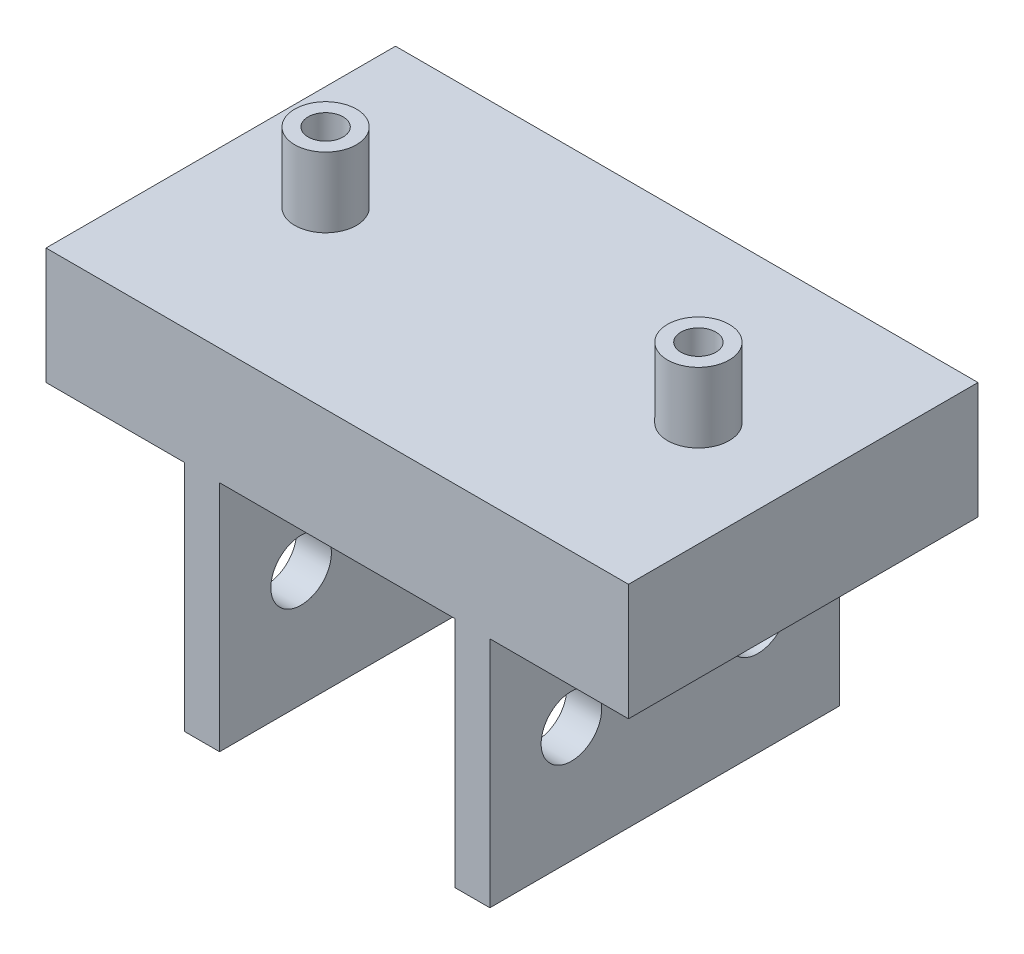
from build123d import *

# Parameters (mm, degrees)
EXTRUDE_1_DEPTH          = 30
SKETCH_2_R               = 2.6
CUT_EXTRUDE_1_DEPTH      = 55.558317423
CUT_EXTRUDE_2_DEPTH      = 50.244289009
CUT_EXTRUDE_2_DEPTH_BACK = 50.244289009
SKETCH_3_R               = 1.5
SKETCH_4_W               = 10
SKETCH_4_H               = 6
CUT_EXTRUDE_3_DEPTH      = 55.558317423
EXTRUDE_START            = 6
SKETCH_5_R               = 2.65
SKETCH_5_R_2             = 1.5
EXTRUDE_2_DEPTH          = 6


with BuildPart() as part:
    # 草图1 → 凸台-拉伸1 (new body)
    with BuildSketch(Plane.XY):
        Polygon((-25, -5), (-13.1, -5), (-13.1, -25), (-10.1, -25), (-10.1, -5), (10.1, -5), (10.1, -25), (13.1, -25), (13.1, -5), (25, -5), (25, 5), (-25, 5), align=None)
    extrude(amount=EXTRUDE_1_DEPTH)

    # 草图2 → 切除-拉伸1 (cut, through all)
    with BuildSketch(Plane(origin=(13.1, 0, 0), x_dir=(0, 0, -1), z_dir=(1, 0, 0))):
        with Locations((-23, -15)):
            Circle(SKETCH_2_R)
        with Locations((-7, -15)):
            Circle(SKETCH_2_R)
    extrude(amount=-CUT_EXTRUDE_1_DEPTH, mode=Mode.SUBTRACT)

    # 草图3 → 切除-拉伸2 (cut, two sides: drawn at the far end of the back side and taken through both)
    with BuildSketch(Plane(origin=(0, 5, 0), x_dir=(1, 0, 0), z_dir=(0, 1, 0)).offset(-CUT_EXTRUDE_2_DEPTH_BACK)):
        with Locations(Location((16, -15, 0), (0, 0, 270))):
            Circle(SKETCH_3_R)
        with Locations(Location((-16, -15, 0), (0, 0, 180))):
            Circle(SKETCH_3_R)
    extrude(amount=CUT_EXTRUDE_2_DEPTH + CUT_EXTRUDE_2_DEPTH_BACK, mode=Mode.SUBTRACT)

    # 草图4 → 切除-拉伸3 (cut, through all)
    with BuildSketch(Plane(origin=(13.1, 0, 0), x_dir=(0, 0, -1), z_dir=(1, 0, 0))):
        with Locations((-15, -8)):
            Rectangle(SKETCH_4_W, SKETCH_4_H)
    extrude(amount=-CUT_EXTRUDE_3_DEPTH, mode=Mode.SUBTRACT)

    # 草图5 → 凸台-拉伸2 (add)
    # profile 1 of 2: a face of its own
    with BuildSketch(Plane(origin=(0, 5, 0), x_dir=(1, 0, 0), z_dir=(0, 1, 0)).offset(EXTRUDE_START)):
        with Locations((16, -15)):
            Circle(SKETCH_5_R)
        with Locations(Location((16, -15, 0), (0, 0, 180))):
            Circle(SKETCH_5_R_2, mode=Mode.SUBTRACT)
    # profile 2 of 2: a face of its own
    with BuildSketch(Plane(origin=(0, 5, 0), x_dir=(1, 0, 0), z_dir=(0, 1, 0)).offset(EXTRUDE_START)):
        with Locations((-16, -15)):
            Circle(SKETCH_5_R)
        with Locations(Location((-16, -15, 0), (0, 0, 180))):
            Circle(SKETCH_5_R_2, mode=Mode.SUBTRACT)
    extrude(amount=-EXTRUDE_2_DEPTH)


solid = part.part
